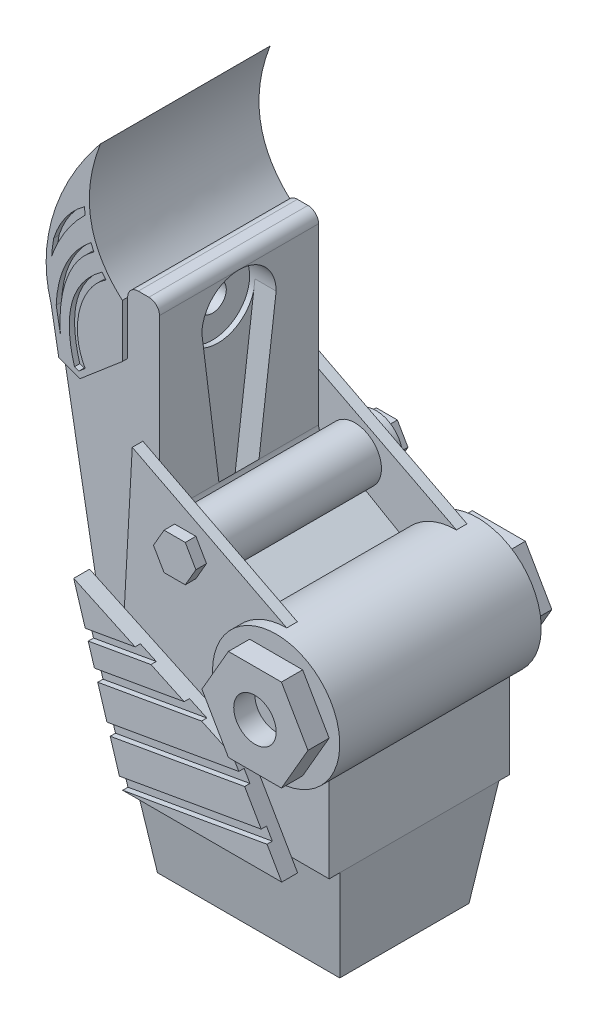
from build123d import *

# Parameters (mm, degrees)
BOSS_EXTRUDE1_DEPTH       = 15
SKETCH2_W                 = 20
SKETCH2_H                 = 15
BOSS_EXTRUDE2_DEPTH       = 10
BOSS_EXTRUDE2_TAPER       = 8
SHELL1_T                  = -2
SKETCH4_R                 = 1.3
CUT_EXTRUDE1_DEPTH        = 54.084837911
SKETCH5_R                 = 1.3
CUT_EXTRUDE2_DEPTH        = 2
SKETCH20_R                = 3.5
CUT_EXTRUDE8_DEPTH        = 0.5
BOSS_EXTRUDE3_DEPTH       = 2
BOSS_EXTRUDE3_DEPTH_BACK  = 17
SKETCH7_R                 = 6
BOSS_EXTRUDE4_DEPTH       = 2
BOSS_EXTRUDE4_DEPTH_BACK  = 21
SKETCH9_R                 = 2
CUT_EXTRUDE4_DEPTH        = 2
BOSS_EXTRUDE5_DEPTH       = 1
BOSS_EXTRUDE6_DEPTH       = 1.5
CUT_EXTRUDE6_DEPTH        = 0.5
BOSS_EXTRUDE10_DEPTH      = 15
BOSS_EXTRUDE11_DEPTH      = 0.5
BOSS_EXTRUDE11_DEPTH_BACK = 15.5
CUT_EXTRUDE7_DEPTH        = 0.5
BOSS_EXTRUDE12_DEPTH      = 1
BOSS_EXTRUDE12_DEPTH_BACK = 17
SKETCH18_R                = 2.5
BOSS_EXTRUDE13_DEPTH      = 1
BOSS_EXTRUDE13_DEPTH_BACK = 19
SKETCH21_R                = 1.3
CUT_EXTRUDE9_DEPTH        = 57.115951472


with BuildPart() as part:
    # Sketch1 → Boss-Extrude1 (new body)
    with BuildSketch(Plane.XY):
        with BuildLine():
            Line((0, -1), (0, -17.422649731))
            ThreePointArc((0, -17.422649731), (0.133974596, -17.922649731), (0.5, -18.288675135))
            Line((0.5, -18.288675135), (16.5, -27.526279442))
            ThreePointArc((16.5, -27.526279442), (16.866025404, -27.892304845), (17, -28.392304845))
            Line((17, -28.392304845), (17, -38))
            Line((17, -38), (-3, -38))
            Line((-3, -38), (-3, -1))
            ThreePointArc((-3, -1), (-2.707106781, -0.292893219), (-2, 0))
            Line((-2, 0), (-1, 0))
            ThreePointArc((-1, 0), (-0.292893219, -0.292893219), (0, -1))
        make_face()
    extrude(amount=BOSS_EXTRUDE1_DEPTH)

    # Sketch2 → Boss-Extrude2 (add)
    with BuildSketch(Plane.XZ.offset(38)):
        with Locations((7, 7.5)):
            Rectangle(SKETCH2_W, SKETCH2_H)
    extrude(amount=BOSS_EXTRUDE2_DEPTH, taper=BOSS_EXTRUDE2_TAPER)

    # Shell1
    shell1_openings = [part.faces().sort_by_distance(p)[0] for p in [
        (7, -48, 7.5),
    ]]
    offset(amount=SHELL1_T, openings=shell1_openings, kind=Kind.INTERSECTION)

    # Sketch4 → Cut-Extrude1 (cut, through all)
    with BuildSketch(Plane(origin=(0, 0, 0), x_dir=(0, 0, -1), z_dir=(1, 0, 0))):
        with Locations(Location((-7.5, -4.5, 0), (0, 0, 90))):
            Circle(SKETCH4_R)
    extrude(amount=-CUT_EXTRUDE1_DEPTH, mode=Mode.SUBTRACT)

    # Sketch5 → Cut-Extrude2 (cut)
    # profile 1 of 2: a face of its own
    with BuildSketch(Plane(origin=(0, 0, 0), x_dir=(0, 0, -1), z_dir=(1, 0, 0))):
        with BuildLine():
            Line((-4.107692308, -5.361538462), (-4, -4.5))
            ThreePointArc((-4, -4.5), (-7.5, -1), (-11, -4.5))
            Line((-11, -4.5), (-10.893527978, -5.356719245))
            Line((-10.893527978, -5.356719245), (-9.393988861, -17.422649731))
            Line((-9.393988861, -17.422649731), (-5.615331216, -17.422649731))
            Line((-5.615331216, -17.422649731), (-4.107692308, -5.361538462))
        make_face()
        with Locations(Location((-7.5, -4.5, 0), (0, 0, 90))):
            Circle(SKETCH5_R, mode=Mode.SUBTRACT)
    # profile 2 of 2: a face of its own
    with BuildSketch(Plane(origin=(0, 0, 0), x_dir=(0, 0, -1), z_dir=(1, 0, 0))):
        with BuildLine():
            Line((-6, -20.5), (-5.615331216, -17.422649731))
            Line((-5.615331216, -17.422649731), (-9.393988861, -17.422649731))
            Line((-9.393988861, -17.422649731), (-8.988548572, -20.684995))
            ThreePointArc((-8.988548572, -20.684995), (-7.407325455, -21.997134406), (-6, -20.5))
        make_face()
    extrude(amount=-CUT_EXTRUDE2_DEPTH, mode=Mode.SUBTRACT)

    # Sketch20 → Cut-Extrude8 (cut)
    with BuildSketch(Plane(origin=(-2, 0, 0), x_dir=(0, 0, -1), z_dir=(1, 0, 0))):
        with Locations(Location((-7.5, -4.5, 0), (0, 0, 90))):
            Circle(SKETCH20_R)
    extrude(amount=-CUT_EXTRUDE8_DEPTH, mode=Mode.SUBTRACT)

    # Sketch7 → Boss-Extrude3 (add, two sides: drawn at the far end of the back side and taken through both)
    with BuildSketch(Plane(origin=(0, 0, 0), x_dir=(-1, 0, 0), z_dir=(0, 0, -1)).offset(-BOSS_EXTRUDE3_DEPTH_BACK)):
        with Locations((-13, -25.505553499)):
            Circle(SKETCH7_R)
    extrude(amount=BOSS_EXTRUDE3_DEPTH + BOSS_EXTRUDE3_DEPTH_BACK)

    # Sketch8 → Boss-Extrude4 (add, two sides: drawn at the far end of the back side and taken through both)
    with BuildSketch(Plane(origin=(0, 0, -2), x_dir=(-1, 0, 0), z_dir=(0, 0, -1)).offset(-BOSS_EXTRUDE4_DEPTH_BACK)):
        Polygon((-10.5, -21.175426481), (-15.5, -21.175426481), (-18, -25.505553499), (-15.5, -29.835680518), (-10.5, -29.835680518), (-8, -25.505553499), align=None)
    extrude(amount=BOSS_EXTRUDE4_DEPTH + BOSS_EXTRUDE4_DEPTH_BACK)

    # Sketch9 → Cut-Extrude4 (cut)
    with BuildSketch(Plane(origin=(0, 0, -4), x_dir=(-1, 0, 0), z_dir=(0, 0, -1))):
        with Locations((-13, -25.505553499)):
            Circle(SKETCH9_R)
    cut_extrude4 = extrude(amount=-CUT_EXTRUDE4_DEPTH, mode=Mode.SUBTRACT)

    # Sketch10 → Boss-Extrude5 (add)
    with BuildSketch(Plane(origin=(0, 0, 0), x_dir=(-1, 0, 0), z_dir=(0, 0, -1))):
        with BuildLine():
            ThreePointArc((-13, -19.505553499), (-7.394965846, -27.646486038), (-17, -29.977689454))
            Line((-17, -29.977689454), (-17, -38))
            Line((-17, -38), (3, -38))
            Line((3, -38), (1.567862336, -12.039472623))
            Line((1.567862336, -12.039472623), (-13, -19.505553499))
        make_face()
    boss_extrude5 = extrude(amount=BOSS_EXTRUDE5_DEPTH)

    # Sketch11 → Boss-Extrude6 (add)
    with BuildSketch(Plane(origin=(0, 0, -1), x_dir=(-1, 0, 0), z_dir=(0, 0, -1))):
        Polygon((-9.411729088, -31), (-14.027386744, -39), (0.972613256, -39), (5.588270912, -24), align=None)
    boss_extrude6 = extrude(amount=BOSS_EXTRUDE6_DEPTH)

    # Sketch12 → Cut-Extrude6 (cut)
    with BuildSketch(Plane(origin=(0, 0, -2.5), x_dir=(-1, 0, 0), z_dir=(0, 0, -1))):
        Polygon((-12.090204, -35.642415208), (-12.64229919, -36.599323596), (0.972613256, -39), (1.280323767, -38), align=None)
        Polygon((-9.979490824, -31.984062127), (-10.531586015, -32.940970515), (2.149020224, -35.176903526), (2.456730734, -34.176903526), align=None)
        Polygon((-6.469091529, -29.626769139), (3.325427191, -31.353807053), (3.633137701, -30.353807053), (-4.829483316, -28.86161864), align=None)
        Polygon((-1.695293127, -27.398996552), (4.221341185, -28.442258816), (4.501834158, -27.530710579), (-0.200711151, -26.701524963), align=None)
    cut_extrude6 = extrude(amount=-CUT_EXTRUDE6_DEPTH, mode=Mode.SUBTRACT)

    # Sketch15 → Boss-Extrude10 (add)
    with BuildSketch(Plane(origin=(0, 0, 0), x_dir=(-1, 0, 0), z_dir=(0, 0, -1))):
        with BuildLine():
            Line((9.725122448, -4.633156539), (3.748016243, -38))
            Line((3.748016243, -38), (3, -38))
            Line((3, -38), (3, -1))
            add(Edge.make_bspline(
                [(3, -1), (7.918744346, 3.306061688), (5.073533391, 10.729889886)],
                knots=[0, 0, 0, 1, 1, 1], degree=2))
            add(Edge.make_bspline(
                [(5.073533391, 10.729889886), (8.436122296, 6.649881722), (11.349749728, 0.686429256), (9.725122448, -4.633156539)],
                knots=[0, 0, 0, 0, 1, 1, 1, 1], degree=3))
        make_face()
    extrude(amount=-BOSS_EXTRUDE10_DEPTH)

    # Sketch16 → Boss-Extrude11 (add, two sides: drawn at the far end of the back side and taken through both)
    with BuildSketch(Plane(origin=(0, 0, 0), x_dir=(-1, 0, 0), z_dir=(0, 0, -1)).offset(-BOSS_EXTRUDE11_DEPTH_BACK)):
        with BuildLine():
            add(Edge.make_bspline(
                [(5.073533391, 10.729889886), (7.918744337, 3.306061712), (3.000000032, -0.999999972)],
                knots=[0, 0, 0, 1, 1, 1], degree=2))
            Line((3.000000032, -0.999999972), (3.000000032, -5.999999972))
            Line((3.000000032, -5.999999972), (7.000000032, -9.402895175))
            Line((7.000000032, -9.402895175), (9.000000032, -8.681109731))
            Line((9.000000032, -8.681109731), (9.725122448, -4.633156539))
            add(Edge.make_bspline(
                [(9.725122448, -4.633156539), (11.349749728, 0.686429256), (8.436122296, 6.649881722), (5.073533391, 10.729889886)],
                knots=[0, 0, 0, 0, 1, 1, 1, 1], degree=3))
        make_face()
    extrude(amount=BOSS_EXTRUDE11_DEPTH + BOSS_EXTRUDE11_DEPTH_BACK)

    # Sketch17 → Cut-Extrude7 (cut)
    with BuildSketch(Plane(origin=(0, 0, -0.5), x_dir=(-1, 0, 0), z_dir=(0, 0, -1))):
        with BuildLine():
            add(Edge.make_bspline(
                [(4.919373973, 0.351324217), (4.890654031, 0.311700406), (4.832500614, 0.232771464), (4.743135653, 0.115335265), (4.651577508, -0.001199548), (4.589227725, -0.078152292), (4.557667982, -0.116497177)],
                knots=[0.50025227, 0.50025227, 0.50025227, 0.50025227, 0.500268998, 0.500285726, 0.500302454, 0.500319182, 0.500319182, 0.500319182, 0.500319182], degree=3))
            add(Edge.make_bspline(
                [(4.557667982, -0.116497177), (7.093366344, -1.803200268), (8.02514456, -5.689793742), (6.50393918, -8.324429723)],
                knots=[0, 0, 0, 0, 1, 1, 1, 1], degree=3))
            Line((6.50393918, -8.324429723), (7.103077292, -8.834130775))
            Line((7.103077292, -8.834130775), (7.515565477, -8.685266791))
            add(Edge.make_bspline(
                [(4.919373973, 0.351324217), (9.239607313, -2.763633122), (7.515565477, -8.685266791)],
                knots=[0, 0, 0, 1, 1, 1], degree=2))
        make_face()
        with BuildLine():
            add(Edge.make_bspline(
                [(5.964761214, 2.231353915), (5.943347571, 2.178397394), (5.899466174, 2.072907805), (5.830489877, 1.915955288), (5.758363633, 1.760294099), (5.708183305, 1.657387648), (5.682570161, 1.606153111)],
                knots=[0.500002421, 0.500002421, 0.500002421, 0.500002421, 0.500022448, 0.500042475, 0.500062501, 0.500082528, 0.500082528, 0.500082528, 0.500082528], degree=3))
            add(Edge.make_bspline(
                [(5.682570161, 1.606153111), (8.286420223, -0.188951179), (9.102386244, -3.758369497), (8.838105421, -6.749226635)],
                knots=[0, 0, 0, 0, 1, 1, 1, 1], degree=3))
            Line((8.838105421, -6.749226635), (9.238215331, -4.515636622))
            add(Edge.make_bspline(
                [(5.964761214, 2.231353915), (9.049757947, -0.261617543), (9.238215331, -4.515636622)],
                knots=[0, 0, 0, 1, 1, 1], degree=2))
        make_face()
        with BuildLine():
            add(Edge.make_bspline(
                [(6.581047642, 4.85506811), (6.576440987, 4.800101376), (6.566321088, 4.690479776), (6.548410143, 4.527030695), (6.527769435, 4.364546001), (6.512186901, 4.256875343), (6.503939181, 4.203204311)],
                knots=[0.499690254, 0.499690254, 0.499690254, 0.499690254, 0.499708876, 0.499727497, 0.499746119, 0.499764741, 0.499764741, 0.499764741, 0.499764741], degree=3))
            add(Edge.make_bspline(
                [(6.503939181, 4.203204311), (8.646134709, 2.123362482), (9.666730852, -0.733925392)],
                knots=[0, 0, 0, 1, 1, 1], degree=2))
            add(Edge.make_bspline(
                [(9.666730852, -0.733925392), (9.658924192, -0.60341537), (9.639048273, -0.342288841), (9.597120908, 0.05013664), (9.543174212, 0.442635455), (9.499487524, 0.704325744), (9.475756374, 0.835118919)],
                knots=[0.241377663, 0.241377663, 0.241377663, 0.241377663, 0.266149151, 0.290920638, 0.315692126, 0.340463613, 0.340463613, 0.340463613, 0.340463613], degree=3))
            add(Edge.make_bspline(
                [(6.581047642, 4.85506811), (8.658782502, 3.351452008), (9.475756374, 0.835118919)],
                knots=[0, 0, 0, 1, 1, 1], degree=2))
        make_face()
    cut_extrude7 = extrude(amount=-CUT_EXTRUDE7_DEPTH, mode=Mode.SUBTRACT)

    # Sketch18 → Boss-Extrude12 (add, two sides: drawn at the far end of the back side and taken through both)
    with BuildSketch(Plane(origin=(0, 0, -1), x_dir=(-1, 0, 0), z_dir=(0, 0, -1)).offset(-BOSS_EXTRUDE12_DEPTH_BACK)):
        with Locations((-3.432137664, -18.039472623)):
            Circle(SKETCH18_R)
    extrude(amount=BOSS_EXTRUDE12_DEPTH + BOSS_EXTRUDE12_DEPTH_BACK)

    # Sketch19 → Boss-Extrude13 (add, two sides: drawn at the far end of the back side and taken through both)
    with BuildSketch(Plane(origin=(0, 0, -2), x_dir=(-1, 0, 0), z_dir=(0, 0, -1)).offset(-BOSS_EXTRUDE13_DEPTH_BACK)):
        Polygon((-1.432137664, -18.039472623), (-2.432137664, -16.307421815), (-4.432137664, -16.307421815), (-5.432137664, -18.039472623), (-4.432137664, -19.77152343), (-2.432137664, -19.77152343), align=None)
    extrude(amount=BOSS_EXTRUDE13_DEPTH + BOSS_EXTRUDE13_DEPTH_BACK)

    # Mirror1: Cut-Extrude4, Boss-Extrude5, Boss-Extrude6, Cut-Extrude6, Cut-Extrude7 across plane
    add(cut_extrude4.mirror(Plane.XY.offset(7.5)), mode=Mode.SUBTRACT)
    add(boss_extrude5.mirror(Plane.XY.offset(7.5)))
    add(boss_extrude6.mirror(Plane.XY.offset(7.5)))
    add(cut_extrude6.mirror(Plane.XY.offset(7.5)), mode=Mode.SUBTRACT)
    add(cut_extrude7.mirror(Plane.XY.offset(7.5)), mode=Mode.SUBTRACT)

    # Sketch21 → Cut-Extrude9 (cut, through all)
    with BuildSketch(Plane(origin=(-3, 0, 0), x_dir=(0, 0, -1), z_dir=(1, 0, 0))):
        with Locations(Location((-7.5, -4.5, 0), (0, 0, 90))):
            Circle(SKETCH21_R)
    extrude(amount=-CUT_EXTRUDE9_DEPTH, mode=Mode.SUBTRACT)


solid = part.part
